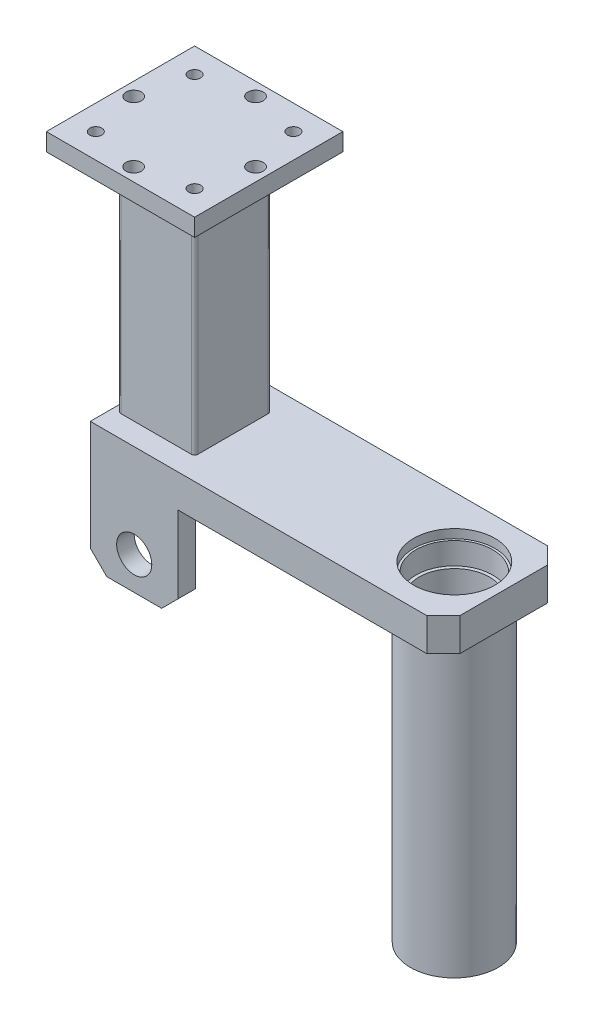
from build123d import *

# Parameters (mm, degrees)
SCHIZZO1_W                = 135
SCHIZZO1_H                = 135
SCHIZZO1_R                = 5.5
ESTRUSIONE1_DEPTH         = 16
SCHIZZO2_W                = 62
SCHIZZO2_H                = 62
ESTRUSIONE_SOTTILE1_DEPTH = 205
SCHIZZO3_W                = 321.5
SCHIZZO3_H                = 110
ESTRUSIONE2_DEPTH         = 30
SCHIZZO4_R                = 40
ESTRUSIONE3_DEPTH         = 270
SCHIZZO6_R                = 32
ESTRUSIONE4_DEPTH         = 642.456935421
SCHIZZO7_R                = 35
ESTRUSIONE5_DEPTH         = 28
ESTRUSIONE6_START         = -28
SCHIZZO8_R                = 35
ESTRUSIONE6_DEPTH         = 28
SCHIZZO9_W                = 80
SCHIZZO9_H                = 16
ESTRUSIONE7_DEPTH         = 85
SCHIZZO10_R               = 16
ESTRUSIONE8_DEPTH         = 40
SCHIZZO11_R               = 17.5
ESTRUSIONE9_DEPTH         = 40
SMUSSO1_SIZE              = 15
SCHIZZO12_R               = 37
ESTRUSIONE10_DEPTH        = 8
ESTRUSIONE11_START        = -8
SCHIZZO13_R               = 37
ESTRUSIONE11_DEPTH        = 8
M16_TAPPED_HOLE1_D        = 14
M16_TAPPED_HOLE1_DEPTH    = 42
M16_TAPPED_HOLE1_TIP      = 4.206024333


with BuildPart() as part:
    # Schizzo1 → Estrusione1 (new body)
    with BuildSketch(Plane(origin=(0, 0, 0), x_dir=(1, 0, 0), z_dir=(0, 1, 0))):
        with Locations((67.5, 67.5)):
            Rectangle(SCHIZZO1_W, SCHIZZO1_H)
        with Locations((22.5, 112.5)):
            Circle(SCHIZZO1_R, mode=Mode.SUBTRACT)
        with Locations((112.5, 112.5)):
            Circle(SCHIZZO1_R, mode=Mode.SUBTRACT)
        with Locations((112.5, 22.5)):
            Circle(SCHIZZO1_R, mode=Mode.SUBTRACT)
        with Locations((22.5, 22.5)):
            Circle(SCHIZZO1_R, mode=Mode.SUBTRACT)
    extrude(amount=ESTRUSIONE1_DEPTH)

    # Schizzo2 → Estrusione-Sottile1 (add)
    with BuildSketch(Plane.XZ):
        with BuildLine():
            Line((32.5, -99.5), (32.5, -35.5))
            ThreePointArc((32.5, -35.5), (33.378679656, -33.378679656), (35.5, -32.5))
            Line((35.5, -32.5), (99.5, -32.5))
            ThreePointArc((99.5, -32.5), (101.621320344, -33.378679656), (102.5, -35.5))
            Line((102.5, -35.5), (102.5, -99.5))
            ThreePointArc((102.5, -99.5), (101.621320344, -101.621320344), (99.5, -102.5))
            Line((99.5, -102.5), (35.5, -102.5))
            ThreePointArc((35.5, -102.5), (33.378679656, -101.621320344), (32.5, -99.5))
        make_face()
        with Locations((67.5, -67.5)):
            Rectangle(SCHIZZO2_W, SCHIZZO2_H, mode=Mode.SUBTRACT)
    extrude(amount=ESTRUSIONE_SOTTILE1_DEPTH)

    # Schizzo3 → Estrusione2 (add)
    with BuildSketch(Plane.XZ.offset(205)):
        with Locations((188.25, -67.5)):
            Rectangle(SCHIZZO3_W, SCHIZZO3_H)
    extrude(amount=ESTRUSIONE2_DEPTH)

    # Schizzo4 → Estrusione3 (add)
    with BuildSketch(Plane.XZ.offset(235)):
        with Locations((304, -67.5)):
            Circle(SCHIZZO4_R)
    extrude(amount=ESTRUSIONE3_DEPTH)

    # Schizzo6 → Estrusione4 (cut, through all)
    with BuildSketch(Plane.XZ.offset(505)):
        with Locations((304, -67.5)):
            Circle(SCHIZZO6_R)
    extrude(amount=-ESTRUSIONE4_DEPTH, mode=Mode.SUBTRACT)

    # Schizzo7 → Estrusione5 (cut)
    with BuildSketch(Plane.XZ.offset(505)):
        with Locations((304, -67.5)):
            Circle(SCHIZZO7_R)
    extrude(amount=-ESTRUSIONE5_DEPTH, mode=Mode.SUBTRACT)

    # Schizzo8 → Estrusione6 (cut)
    with BuildSketch(Plane(origin=(0, -205, 0), x_dir=(1, 0, 0), z_dir=(0, 1, 0)).offset(ESTRUSIONE6_START)):
        with Locations((304, 67.5)):
            Circle(SCHIZZO8_R)
    extrude(amount=ESTRUSIONE6_DEPTH, mode=Mode.SUBTRACT)

    # Schizzo9 → Estrusione7 (add)
    with BuildSketch(Plane.XZ.offset(235)):
        with Locations((67.5, -114.5)):
            Rectangle(SCHIZZO9_W, SCHIZZO9_H)
        with Locations((67.5, -20.5)):
            Rectangle(SCHIZZO9_W, SCHIZZO9_H)
    extrude(amount=ESTRUSIONE7_DEPTH)

    # Schizzo10 → Estrusione8 (cut)
    with BuildSketch(Plane.XY.offset(-12.5)):
        with Locations((67.5, -290)):
            Circle(SCHIZZO10_R)
    extrude(amount=-ESTRUSIONE8_DEPTH, mode=Mode.SUBTRACT)

    # Schizzo11 → Estrusione9 (cut)
    with BuildSketch(Plane(origin=(0, 0, -122.5), x_dir=(-1, 0, 0), z_dir=(0, 0, -1))):
        with Locations((-67.5, -290)):
            Circle(SCHIZZO11_R)
    extrude(amount=-ESTRUSIONE9_DEPTH, mode=Mode.SUBTRACT)

    # Smusso1
    smusso1_edges = [part.edges().sort_by_distance(p)[0] for p in [
        (349, -220, -12.5),
        (349, -220, -122.5),
        (27.5, -320, -20.5),
        (107.5, -320, -20.5),
        (27.5, -320, -114.5),
        (107.5, -320, -114.5),
    ]]
    chamfer(smusso1_edges, length=SMUSSO1_SIZE)

    # Schizzo12 → Estrusione10 (cut)
    with BuildSketch(Plane.XZ.offset(505)):
        with Locations((304, -67.5)):
            Circle(SCHIZZO12_R)
    extrude(amount=-ESTRUSIONE10_DEPTH, mode=Mode.SUBTRACT)

    # Schizzo13 → Estrusione11 (cut)
    with BuildSketch(Plane(origin=(0, -205, 0), x_dir=(1, 0, 0), z_dir=(0, 1, 0)).offset(ESTRUSIONE11_START)):
        with Locations((304, 67.5)):
            Circle(SCHIZZO13_R)
    extrude(amount=ESTRUSIONE11_DEPTH, mode=Mode.SUBTRACT)

    # M16 Tapped Hole1
    with Locations(Plane(origin=(0, 16, 0), x_dir=(-1, 0, 0), z_dir=(0, 1, 0))):
        with Locations((-67.5, -123), (-12, -67.5), (-67.5, -12), (-123, -67.5)):
            Hole(M16_TAPPED_HOLE1_D / 2, depth=M16_TAPPED_HOLE1_DEPTH)
            with Locations((0, 0, -(M16_TAPPED_HOLE1_DEPTH + M16_TAPPED_HOLE1_TIP / 2))):  # 118° drill point
                Cone(0, M16_TAPPED_HOLE1_D / 2, M16_TAPPED_HOLE1_TIP, mode=Mode.SUBTRACT)


solid = part.part
